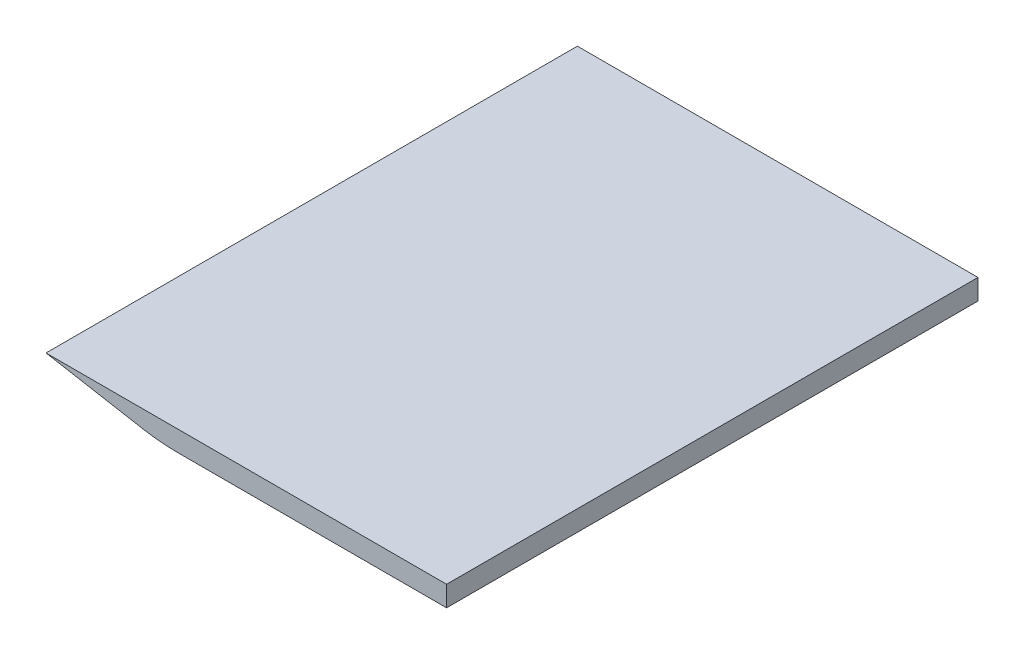
from build123d import *

# Parameters (mm, degrees)
BOSS_EXTRUDE1_DEPTH = 130
FILLET1_R           = 50


with BuildPart() as part:
    # Sketch1 → Boss-Extrude1 (new body)
    with BuildSketch(Plane.XY):
        Polygon((0, 0), (98, 0), (98, -5), (28, -5), align=None)
    extrude(amount=BOSS_EXTRUDE1_DEPTH)

    # Fillet1
    fillet1_edges = [part.edges().sort_by_distance(p)[0] for p in [
        (28, -5, 65),
    ]]
    fillet(fillet1_edges, radius=FILLET1_R)


solid = part.part
